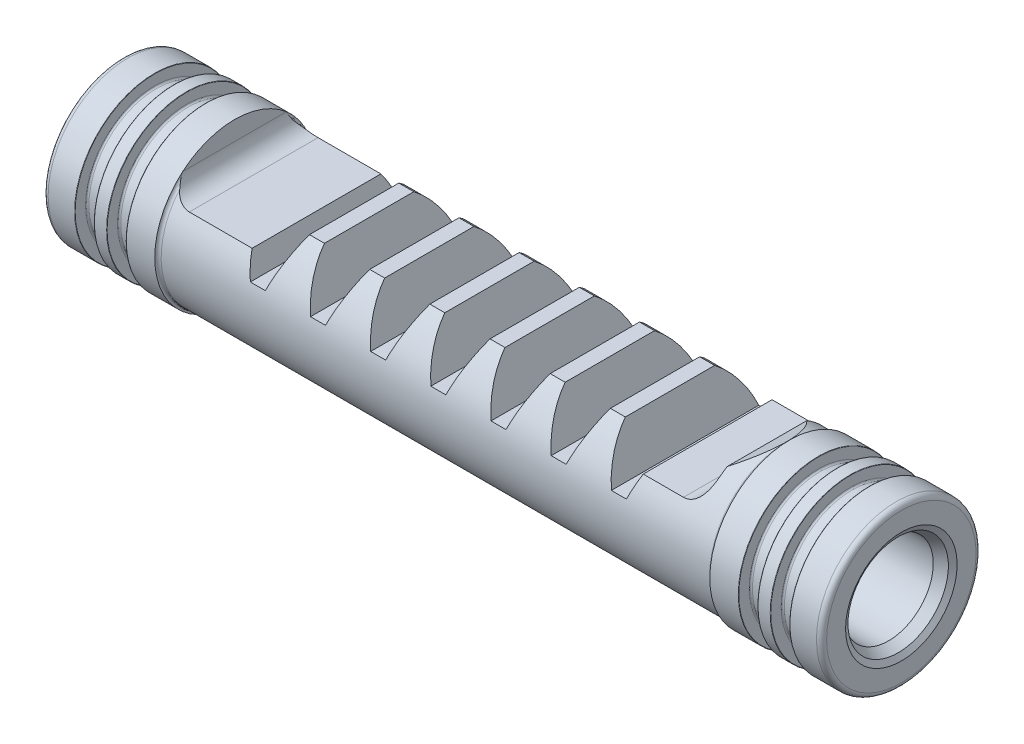
from build123d import *

# Parameters (mm, degrees)
CUT_EXTRUDE_1_DEPTH      = 127.962055884
CUT_EXTRUDE_1_DEPTH_BACK = 127.962055884
CUT_EXTRUDE_3_DEPTH      = 127.962055884
CUT_EXTRUDE_3_DEPTH_BACK = 127.962055884
CUT_EXTRUDE_2_DEPTH      = 127.962055884
PATTERN_LINEAR_1_COUNT   = 7
PATTERN_LINEAR_1_PITCH   = 18.85


with BuildPart() as part:
    # Эскиз1 → Повернуть1 (revolve)
    with BuildSketch(Plane.XY, mode=Mode.PRIVATE) as revolve_1_sk:
        with BuildLine():
            Line((-121.94, 17.464101615), (-121.94, 23.4))
            ThreePointArc((-121.94, 23.4), (-121.47137085, 24.53137085), (-120.34, 25))
            Line((-120.34, 25), (-112.04, 25))
            ThreePointArc((-112.04, 25), (-111.969289322, 24.970710678), (-111.94, 24.9))
            Line((-111.94, 24.9), (-111.94, 21.65))
            ThreePointArc((-111.94, 21.65), (-111.793553391, 21.296446609), (-111.44, 21.15))
            Line((-111.44, 21.15), (-106.44, 21.15))
            ThreePointArc((-106.44, 21.15), (-106.086446609, 21.296446609), (-105.94, 21.65))
            Line((-105.94, 21.65), (-105.94, 24.9))
            ThreePointArc((-105.94, 24.9), (-105.910710678, 24.970710678), (-105.84, 25))
            Line((-105.84, 25), (-102.04, 25))
            ThreePointArc((-102.04, 25), (-101.969289322, 24.970710678), (-101.94, 24.9))
            Line((-101.94, 24.9), (-101.94, 21.65))
            ThreePointArc((-101.94, 21.65), (-101.793553391, 21.296446609), (-101.44, 21.15))
            Line((-101.44, 21.15), (-96.44, 21.15))
            ThreePointArc((-96.44, 21.15), (-96.086446609, 21.296446609), (-95.94, 21.65))
            Line((-95.94, 21.65), (-95.94, 24.9))
            ThreePointArc((-95.94, 24.9), (-95.910710678, 24.970710678), (-95.84, 25))
            Line((-95.84, 25), (-86.94, 25))
            ThreePointArc((-86.94, 25), (-86.647106781, 24.292893219), (-85.94, 24))
            Line((-85.94, 24), (85.94, 24))
            ThreePointArc((85.94, 24), (86.647106781, 24.292893219), (86.94, 25))
            Line((86.94, 25), (95.84, 25))
            ThreePointArc((95.84, 25), (95.910710678, 24.970710678), (95.94, 24.9))
            Line((95.94, 24.9), (95.94, 21.65))
            ThreePointArc((95.94, 21.65), (96.086446609, 21.296446609), (96.44, 21.15))
            Line((96.44, 21.15), (101.44, 21.15))
            ThreePointArc((101.44, 21.15), (101.793553391, 21.296446609), (101.94, 21.65))
            Line((101.94, 21.65), (101.94, 24.9))
            ThreePointArc((101.94, 24.9), (101.969289322, 24.970710678), (102.04, 25))
            Line((102.04, 25), (105.84, 25))
            ThreePointArc((105.84, 25), (105.910710678, 24.970710678), (105.94, 24.9))
            Line((105.94, 24.9), (105.94, 21.65))
            ThreePointArc((105.94, 21.65), (106.086446609, 21.296446609), (106.44, 21.15))
            Line((106.44, 21.15), (111.44, 21.15))
            ThreePointArc((111.44, 21.15), (111.793553391, 21.296446609), (111.94, 21.65))
            Line((111.94, 21.65), (111.94, 24.9))
            ThreePointArc((111.94, 24.9), (111.969289322, 24.970710678), (112.04, 25))
            Line((112.04, 25), (120.34, 25))
            ThreePointArc((120.34, 25), (121.47137085, 24.53137085), (121.94, 23.4))
            Line((121.94, 23.4), (121.94, 17.464101615))
            Line((121.94, 17.464101615), (120.94, 15.732050808))
            Line((120.94, 15.732050808), (117.94, 14))
            Line((117.94, 14), (93.94, 14))
            Line((93.94, 14), (85.857096231, 0))
            Line((85.857096231, 0), (-85.857096231, 0))
            Line((-85.857096231, 0), (-93.94, 14))
            Line((-93.94, 14), (-117.94, 14))
            Line((-117.94, 14), (-120.94, 15.732050808))
            Line((-120.94, 15.732050808), (-121.94, 17.464101615))
        make_face()
    revolve(revolve_1_sk.sketch.rotate(Axis((-137.65589045, 0, 0), (1, 0, 0)), 90), axis=Axis((-137.65589045, 0, 0), (1, 0, 0)))

    # Эскиз3 → Вырез-Вытянуть1 (cut, two sides: drawn at the far end of the back side and taken through both)
    with BuildSketch(Plane.XY.offset(-CUT_EXTRUDE_1_DEPTH_BACK)):
        with BuildLine():
            Line((-86.94, 25), (-86.94, 19))
            ThreePointArc((-86.94, 19), (-85.182640687, 14.757359313), (-80.94, 13))
            Line((-80.94, 13), (-51.84, 13))
            Line((-51.84, 13), (-51.84, 19.5))
            Line((-51.84, 19.5), (51.84, 19.5))
            Line((51.84, 19.5), (51.84, 13))
            Line((51.84, 13), (73.877822174, 13))
            ThreePointArc((73.877822174, 13), (78.120462861, 14.757359313), (79.877822174, 19))
            Line((79.877822174, 19), (79.877822174, 20.5))
            Line((79.877822174, 20.5), (85.94, 24))
            Line((85.94, 24), (85.94, 25))
            Line((85.94, 25), (-86.94, 25))
        make_face()
    extrude(amount=CUT_EXTRUDE_1_DEPTH + CUT_EXTRUDE_1_DEPTH_BACK, mode=Mode.SUBTRACT)

    # Эскиз5 → Вырез-Вытянуть3 (cut, two sides: drawn at the far end of the back side and taken through both)
    with BuildSketch(Plane.XY.offset(-CUT_EXTRUDE_3_DEPTH_BACK)):
        with BuildLine():
            Line((-48.351702841, -24), (-39.64, -17.9))
            Line((-39.64, -17.9), (-24.64, -17.9))
            Line((-24.64, -17.9), (-14.74908129, -21.5))
            Line((-14.74908129, -21.5), (91.94, -21.5))
            Line((91.94, -21.5), (91.94, -24))
            ThreePointArc((91.94, -24), (92.232893219, -24.707106781), (92.94, -25))
            Line((92.94, -25), (-48.351702841, -25))
            Line((-48.351702841, -25), (-48.351702841, -24))
        make_face()
    extrude(amount=CUT_EXTRUDE_3_DEPTH + CUT_EXTRUDE_3_DEPTH_BACK, mode=Mode.SUBTRACT)

    # Эскиз4 → Вырез-Вытянуть2 (cut, symmetric)
    with BuildSketch(Plane.XY):
        Polygon((-54.205806523, 6.5), (-49.474193477, 19.5), (-63.630806523, 19.5), (-58.899193477, 6.5), align=None)
    cut_extrude_2 = extrude(amount=CUT_EXTRUDE_2_DEPTH, both=True, mode=Mode.SUBTRACT)

    # Линейный массив1: Вырез-Вытянуть2 ×7
    with Locations(*[(i * PATTERN_LINEAR_1_PITCH, 0, 0) for i in range(1, PATTERN_LINEAR_1_COUNT)]):
        add(cut_extrude_2, mode=Mode.SUBTRACT)


solid = part.part
